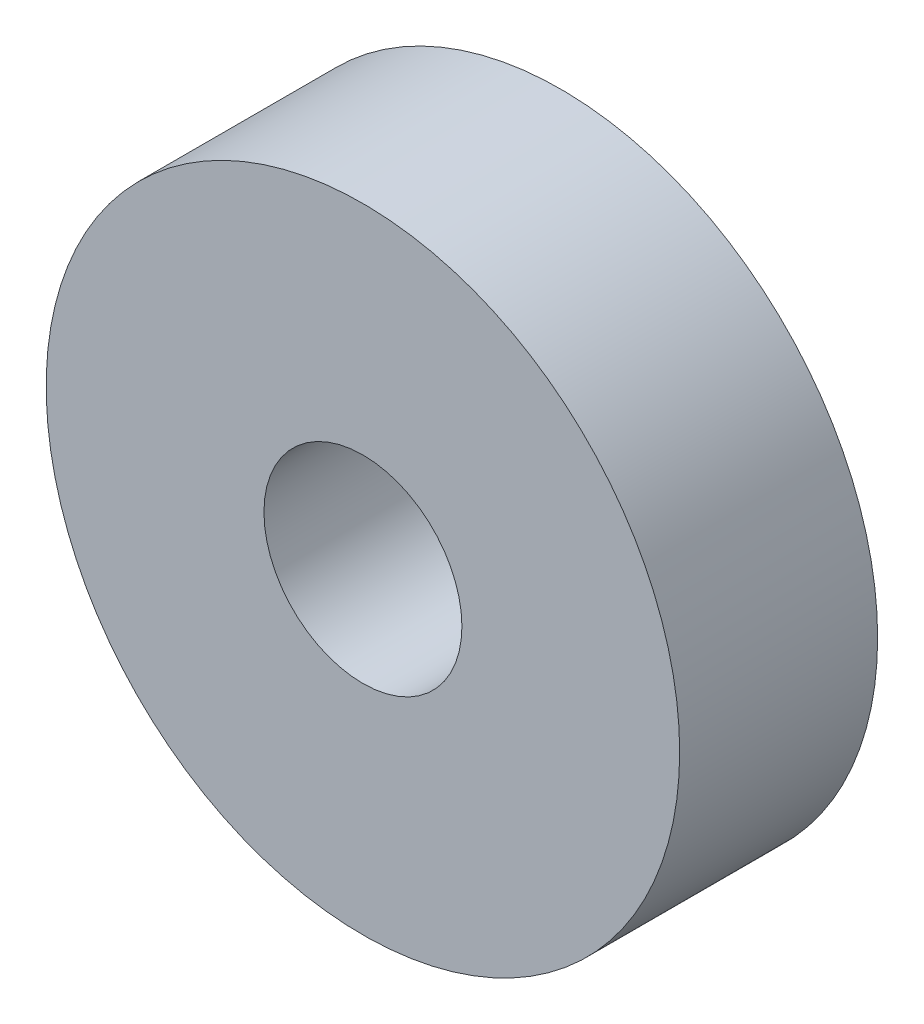
from build123d import *

# Parameters (mm, degrees)
SKETCH_1_R                             = 8
SKETCH_1_R_2                           = 2.5
PURCHASED_625ZZ_5X16X5_NOT_PRINT_DEPTH = 5


with BuildPart() as part:
    # 草图1 → Purchased_625ZZ_5x16x5_NOT_PRINT (new body)
    with BuildSketch(Plane.XY):
        Circle(SKETCH_1_R)
        Circle(SKETCH_1_R_2, mode=Mode.SUBTRACT)
    extrude(amount=PURCHASED_625ZZ_5X16X5_NOT_PRINT_DEPTH)


solid = part.part
